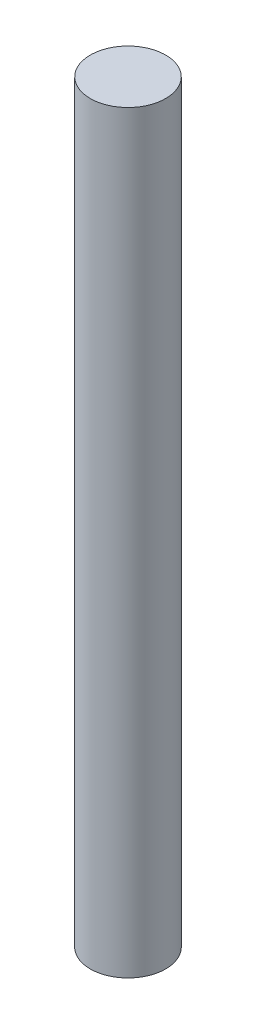
from build123d import *

# Parameters (mm, degrees)
SKETCH1_R           = 12.7
SKETCH1_R_2         = 2
BOSS_EXTRUDE1_DEPTH = 254


with BuildPart() as part:
    # Sketch1 → Boss-Extrude1 (new body)
    # profile 1 of 2: a face of its own
    with BuildSketch(Plane(origin=(0, 0, 0), x_dir=(1, 0, 0), z_dir=(0, 1, 0))):
        with Locations(Location((0, 0, 0), (0, 0, 270))):
            Circle(SKETCH1_R)
        Circle(SKETCH1_R_2, mode=Mode.SUBTRACT)
    # profile 2 of 2: a face of its own
    with BuildSketch(Plane(origin=(0, 0, 0), x_dir=(1, 0, 0), z_dir=(0, 1, 0))):
        Circle(SKETCH1_R_2)
    extrude(amount=BOSS_EXTRUDE1_DEPTH)


solid = part.part
